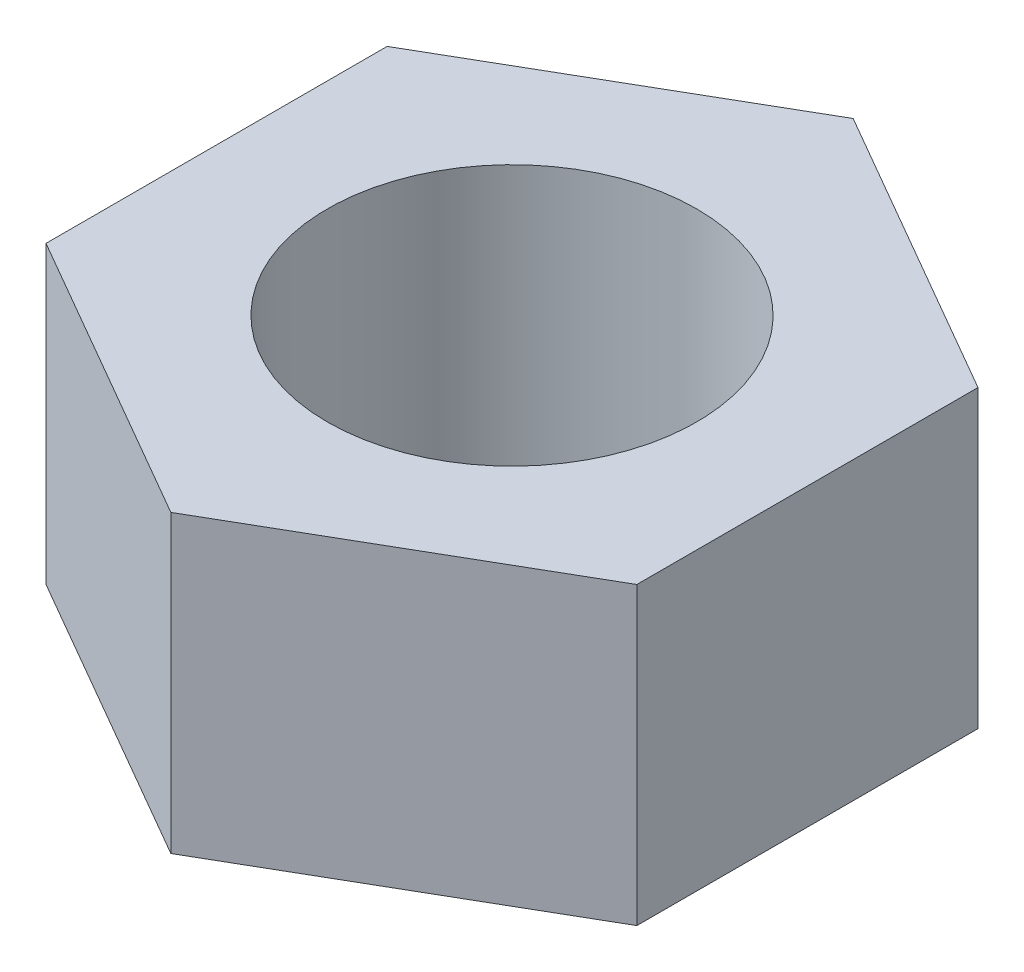
from build123d import *

# Parameters (mm, degrees)
BOSS_EXTRUDE1_DEPTH      = 2
BOSS_EXTRUDE1_DEPTH_BACK = 2
SKETCH1_R                = 2.5


with BuildPart() as part:
    # Sketch1 → Boss-Extrude1 (new, two sides: drawn at the far end of the back side and taken through both)
    with BuildSketch(Plane(origin=(0, 0, 0), x_dir=(1, 0, 0), z_dir=(0, 1, 0)).offset(-BOSS_EXTRUDE1_DEPTH_BACK)):
        Polygon((-4, 2.309401077), (-4, -2.309401077), (0, -4.618802154), (4, -2.309401077), (4, 2.309401077), (0, 4.618802154), align=None)
        Circle(SKETCH1_R, mode=Mode.SUBTRACT)
    extrude(amount=BOSS_EXTRUDE1_DEPTH + BOSS_EXTRUDE1_DEPTH_BACK)


solid = part.part
